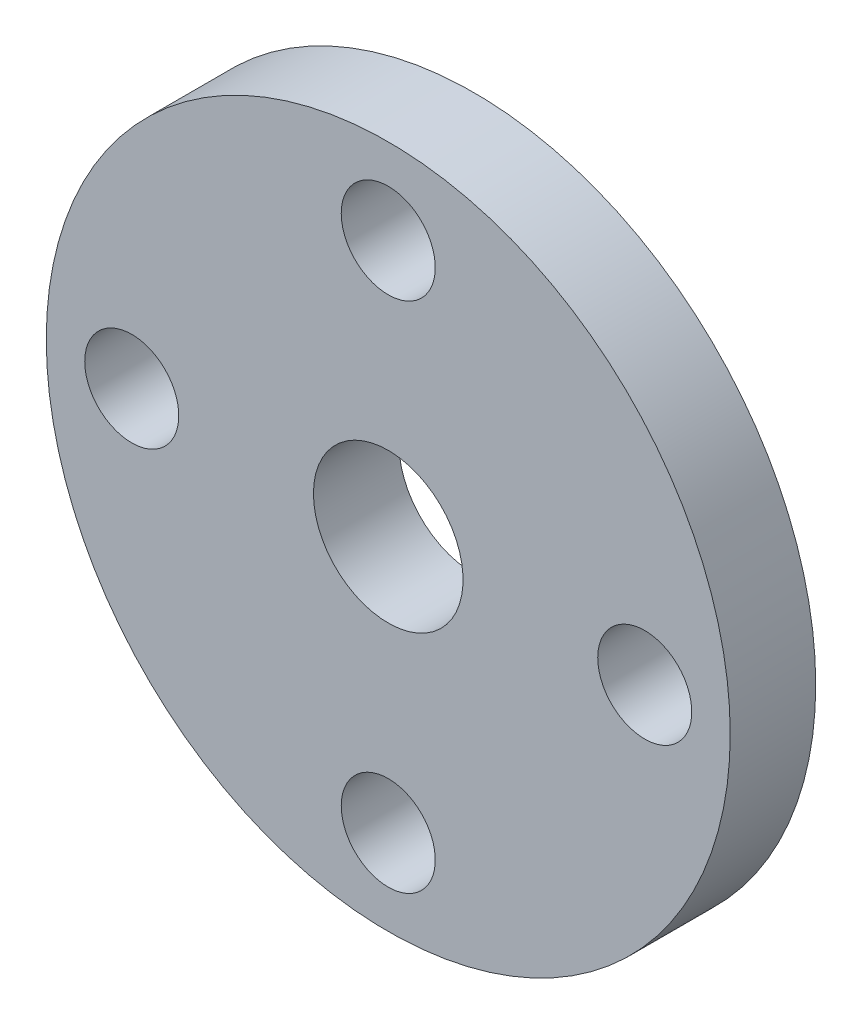
from build123d import *

# Parameters (mm, degrees)
SKETCH_1_R          = 8
EXTRUDE_1_DEPTH     = 2
SKETCH_3_R          = 1.1
SKETCH_3_R_2        = 1.75
CUT_EXTRUDE_1_DEPTH = 12.489125293


with BuildPart() as part:
    # 草图1 → 凸台-拉伸1 (new body)
    with BuildSketch(Plane.XY):
        Circle(SKETCH_1_R)
    extrude(amount=EXTRUDE_1_DEPTH)

    # 草图3 → 切除-拉伸1 (cut, through all)
    with BuildSketch(Plane(origin=(0, 0, 0), x_dir=(-1, 0, 0), z_dir=(0, 0, -1))):
        with Locations((0, 6)):
            Circle(SKETCH_3_R)
        with Locations((6, 0)):
            Circle(SKETCH_3_R)
        with Locations((0, -6)):
            Circle(SKETCH_3_R)
        with Locations((-6, 0)):
            Circle(SKETCH_3_R)
        Circle(SKETCH_3_R_2)
    extrude(amount=-CUT_EXTRUDE_1_DEPTH, mode=Mode.SUBTRACT)


solid = part.part
